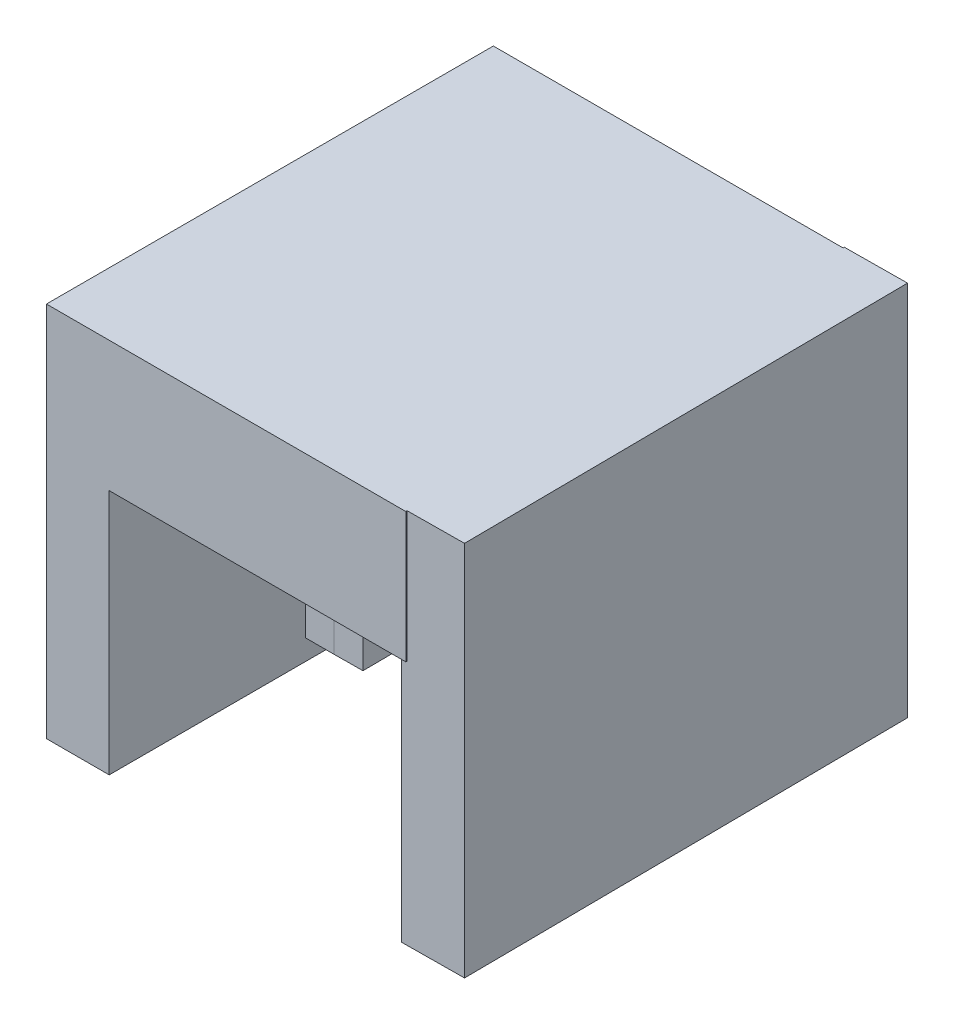
from build123d import *

# Parameters (mm, degrees)
BOSS_EXTRUDE1_DEPTH     = 33
CUT_EXTRUDE1_DEPTH      = 83.954293528
CUT_EXTRUDE1_DEPTH_BACK = 12
SKETCH3_W               = 9.481209811
SKETCH3_H               = 17.021727652
CUT_EXTRUDE2_DEPTH      = 22
SKETCH6_W               = 39.175540074
SKETCH6_H               = 11.416045591
BOSS_EXTRUDE3_DEPTH     = 26


with BuildPart() as part:
    # Sketch1 → Boss-Extrude1 (new body)
    with BuildSketch(Plane(origin=(0, 0, 0), x_dir=(1, 0, 0), z_dir=(0, 1, 0))):
        with BuildLine():
            Line((27.99701897, 26.104397373), (30.497019389, 26.104397373))
            Line((30.497019389, 26.104397373), (32.996926828, 26.125958592))
            Line((32.996926828, 26.125958592), (32.946330796, 31.992296402))
            ThreePointArc((32.946330796, 31.992296402), (34.614300355, 33.056919945), (35.86386473, 34.591238885))
            Line((35.86386473, 34.591238885), (40.431539769, 35.753760832))
            Line((40.431539769, 35.753760832), (43.136211097, 35.223788843))
            Line((43.136211097, 35.223788843), (43.274382132, 19.203600277))
            Line((43.274382132, 19.203600277), (48.774177579, 19.251034952))
            Line((48.774177579, 19.251034952), (48.43630867, 58.425118026))
            Line((48.43630867, 58.425118026), (42.936513223, 58.377683351))
            Line((42.936513223, 58.377683351), (43.088196039, 40.790876563))
            Line((43.088196039, 40.790876563), (40.395268448, 39.959225491))
            Line((40.395268448, 39.959225491), (35.888631414, 40.775372904))
            ThreePointArc((35.888631414, 40.775372904), (33.583892359, 43.097075019), (30.420151943, 43.929462788))
            ThreePointArc((30.420151943, 43.929462788), (27.263708108, 43.06982034), (24.979078258, 40.728327384))
            Line((24.979078258, 40.728327384), (20.479647685, 39.873342894))
            Line((20.479647685, 39.873342894), (17.779647685, 40.681737919))
            Line((17.779647685, 40.681737919), (17.779647685, 58.269198812))
            Line((17.779647685, 58.269198812), (12.279647685, 58.269198812))
            Line((12.279647685, 58.269198812), (12.279647685, 19.093658738))
            Line((12.279647685, 19.093658738), (17.779647685, 19.093658738))
            Line((17.779647685, 19.093658738), (17.779647685, 35.114443143))
            Line((17.779647685, 35.114443143), (20.479647685, 35.667721822))
            Line((20.479647685, 35.667721822), (25.057179, 34.544636961))
            ThreePointArc((25.057179, 34.544636961), (26.319929615, 33.021151936), (27.99701897, 31.970953369))
            Line((27.99701897, 31.970953369), (27.99701897, 26.104397373))
        make_face()
    extrude(amount=BOSS_EXTRUDE1_DEPTH)

    # Sketch2 → Cut-Extrude1 (cut, two sides: drawn at the far end of the back side and taken through both)
    with BuildSketch(Plane.XZ.offset(-CUT_EXTRUDE1_DEPTH_BACK)):
        with BuildLine():
            Line((20.479647685, -35.667721822), (17.779647685, -35.114443143))
            Line((17.779647685, -35.114443143), (17.779647685, -40.681737919))
            Line((17.779647685, -40.681737919), (20.479647685, -39.873342894))
            Line((20.479647685, -39.873342894), (24.979078258, -40.728327384))
            ThreePointArc((24.979078258, -40.728327384), (27.263708108, -43.06982034), (30.420151943, -43.929462788))
            ThreePointArc((30.420151943, -43.929462788), (33.576595778, -43.084424394), (35.888631414, -40.775372904))
            Line((35.888631414, -40.775372904), (40.395268448, -39.959225491))
            Line((40.395268448, -39.959225491), (43.088196039, -40.790876563))
            Line((43.088196039, -40.790876563), (43.136211097, -35.223788843))
            Line((43.136211097, -35.223788843), (40.431539769, -35.753760832))
            Line((40.431539769, -35.753760832), (35.86386473, -34.591238885))
            ThreePointArc((35.86386473, -34.591238885), (34.614300355, -33.056919945), (32.946330796, -31.992296402))
            Line((32.946330796, -31.992296402), (32.996926828, -26.125958592))
            Line((32.996926828, -26.125958592), (27.99701897, -26.104397373))
            Line((27.99701897, -26.104397373), (27.99701897, -31.970953369))
            ThreePointArc((27.99701897, -31.970953369), (26.319929615, -33.021151936), (25.057179, -34.544636961))
            Line((25.057179, -34.544636961), (20.479647685, -35.667721822))
        make_face()
    extrude(amount=CUT_EXTRUDE1_DEPTH + CUT_EXTRUDE1_DEPTH_BACK, mode=Mode.SUBTRACT)

    # Sketch3 → Cut-Extrude2 (cut)
    with BuildSketch(Plane.XY.offset(-26.104397373)):
        with Locations((32.737623876, 3.489136174)):
            Rectangle(SKETCH3_W, SKETCH3_H)
    extrude(amount=-CUT_EXTRUDE2_DEPTH, mode=Mode.SUBTRACT)

    # Sketch6 → Boss-Extrude3 (add)
    with BuildSketch(Plane(origin=(17.779647685, 0, 0), x_dir=(0, 0, -1), z_dir=(1, 0, 0))):
        with Locations((38.681428775, 27.291977205)):
            Rectangle(SKETCH6_W, SKETCH6_H)
    extrude(amount=BOSS_EXTRUDE3_DEPTH)


solid = part.part
